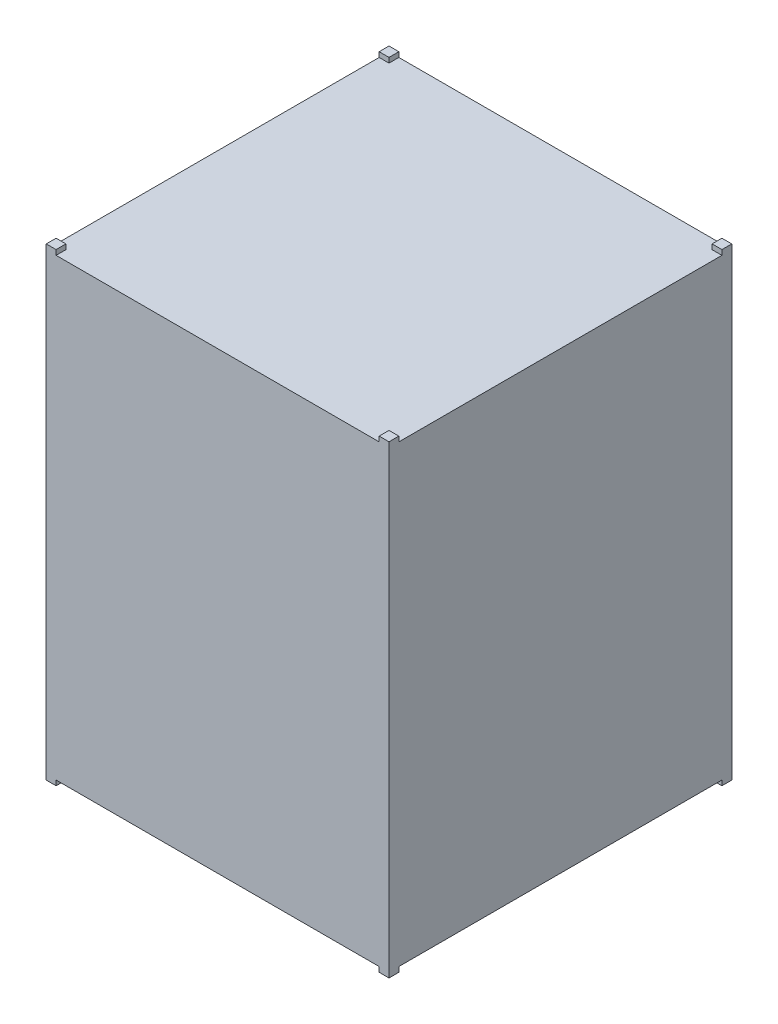
from build123d import *

# Parameters (mm, degrees)
ESTRUSIONE_ESTRUSIONE2_DEPTH      = 150
ESTRUSIONE_ESTRUSIONE2_DEPTH_BACK = 150
ESTRUSIONE_ESTRUSIONE3_DEPTH      = 3.3
ESTRUSIONE_ESTRUSIONE3_DEPTH_BACK = 303.3
SCHIZZO3_W                        = 6.5
SCHIZZO3_H                        = 6.5


with BuildPart() as part:
    # Schizzo2 → Estrusione-Estrusione2 (new, two sides: drawn at the far end of the back side and taken through both)
    with BuildSketch(Plane(origin=(0, 0, 0), x_dir=(1, 0, 0), z_dir=(0, 1, 0)).offset(-ESTRUSIONE_ESTRUSIONE2_DEPTH_BACK)):
        Polygon((-113.15, 106.65), (-113.15, -106.65), (-106.65, -106.65), (-106.65, -113.15), (106.65, -113.15), (106.65, -106.65), (113.15, -106.65), (113.15, 106.65), (106.65, 106.65), (106.65, 113.15), (-106.65, 113.15), (-106.65, 106.65), align=None)
    extrude(amount=ESTRUSIONE_ESTRUSIONE2_DEPTH + ESTRUSIONE_ESTRUSIONE2_DEPTH_BACK)

    # Schizzo3 → Estrusione-Estrusione3 (add, two sides: drawn at the far end of the back side and taken through both)
    with BuildSketch(Plane.XZ.offset(150).offset(-ESTRUSIONE_ESTRUSIONE3_DEPTH_BACK)):
        with Locations((-109.9, 109.9)):
            Rectangle(SCHIZZO3_W, SCHIZZO3_H)
        with Locations((109.9, 109.9)):
            Rectangle(SCHIZZO3_W, SCHIZZO3_H)
        with Locations((109.9, -109.9)):
            Rectangle(SCHIZZO3_W, SCHIZZO3_H)
        with Locations((-109.9, -109.9)):
            Rectangle(SCHIZZO3_W, SCHIZZO3_H)
    extrude(amount=ESTRUSIONE_ESTRUSIONE3_DEPTH + ESTRUSIONE_ESTRUSIONE3_DEPTH_BACK)


solid = part.part
